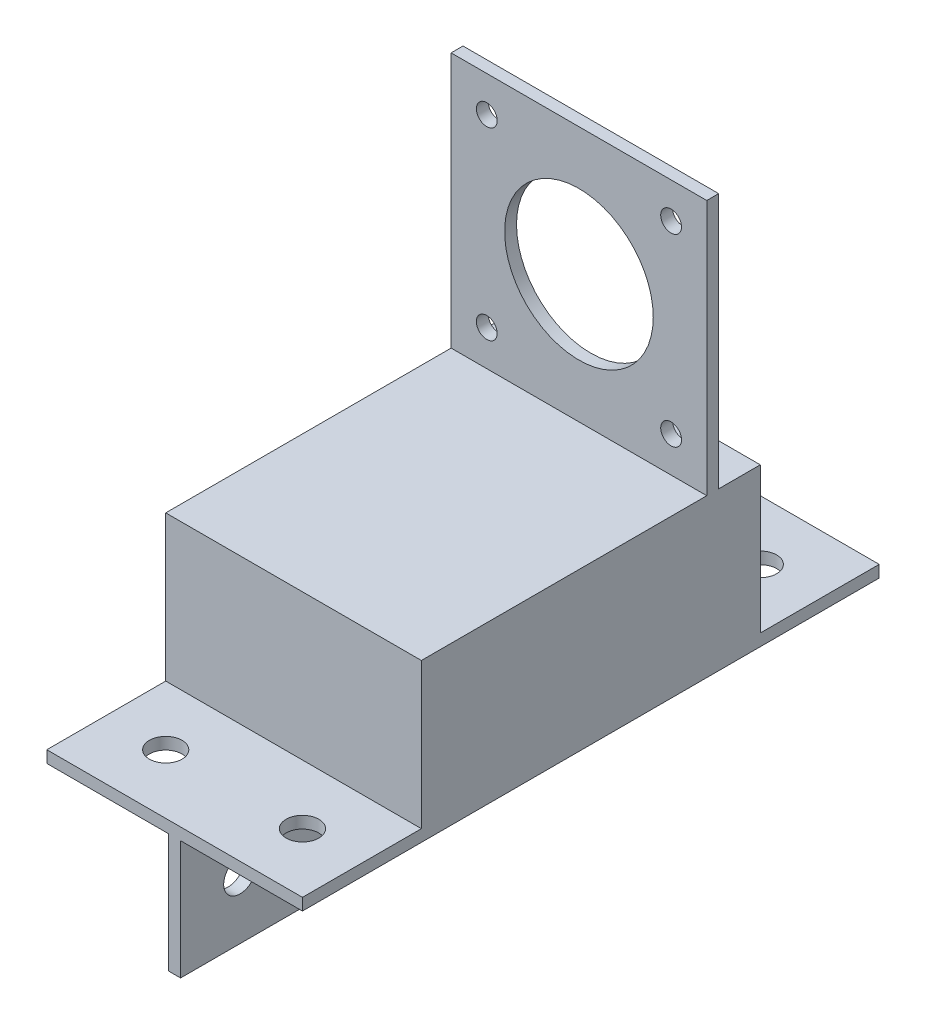
from build123d import *

# Parameters (mm, degrees)
SKETCH1_W           = 43
SKETCH1_H           = 2
BOSS_EXTRUDE1_DEPTH = 43
SKETCH1_3_W         = 43
SKETCH1_3_H         = 97
BOSS_EXTRUDE2_DEPTH = 26.5
CUT_EXTRUDE1_REACH  = 85.278
SKETCH2_R           = 12.5
SKETCH2_R_2         = 1.75
CUT_EXTRUDE2_REACH  = 70.29
SKETCH1_4_R         = 2.75
SKETCH3_W           = 43
SKETCH3_H           = 20
CUT_EXTRUDE3_DEPTH  = 24.5
SKETCH4_W           = 2
SKETCH4_H           = 97
BOSS_EXTRUDE3_DEPTH = 20
CUT_EXTRUDE4_REACH  = 72.857
SKETCH5_R           = 2.75


with BuildPart() as part:
    # Sketch1 → Boss-Extrude1 (new body)
    with BuildSketch(Plane(origin=(0, 0, 0), x_dir=(1, 0, 0), z_dir=(0, 1, 0))):
        with Locations((0, 20.5)):
            Rectangle(SKETCH1_W, SKETCH1_H)
    extrude(amount=BOSS_EXTRUDE1_DEPTH)

    # Sketch1<3> → Boss-Extrude2 (add)
    with BuildSketch(Plane(origin=(0, 0, 0), x_dir=(1, 0, 0), z_dir=(0, 1, 0))):
        Rectangle(SKETCH1_3_W, SKETCH1_3_H)
    extrude(amount=-BOSS_EXTRUDE2_DEPTH)

    # Sketch2 → Cut-Extrude1 (cut, up to next)
    with BuildSketch(Plane.XY.offset(-19.5), mode=Mode.PRIVATE) as cut_extrude1_sk1:
        with Locations((0, 21.5)):
            Circle(SKETCH2_R)
    cut_extrude1_tool1 = extrude(cut_extrude1_sk1.sketch, amount=-CUT_EXTRUDE1_REACH, mode=Mode.PRIVATE) & part.part
    # Sketch2 → Cut-Extrude1 (cut, up to next)
    with BuildSketch(Plane.XY.offset(-19.5), mode=Mode.PRIVATE) as cut_extrude1_sk2:
        with Locations((-15.5, 37)):
            Circle(SKETCH2_R_2)
    cut_extrude1_tool2 = extrude(cut_extrude1_sk2.sketch, amount=-CUT_EXTRUDE1_REACH, mode=Mode.PRIVATE) & part.part
    # Sketch2 → Cut-Extrude1 (cut, up to next)
    with BuildSketch(Plane.XY.offset(-19.5), mode=Mode.PRIVATE) as cut_extrude1_sk3:
        with Locations((15.5, 37)):
            Circle(SKETCH2_R_2)
    cut_extrude1_tool3 = extrude(cut_extrude1_sk3.sketch, amount=-CUT_EXTRUDE1_REACH, mode=Mode.PRIVATE) & part.part
    # Sketch2 → Cut-Extrude1 (cut, up to next)
    with BuildSketch(Plane.XY.offset(-19.5), mode=Mode.PRIVATE) as cut_extrude1_sk4:
        with Locations((15.5, 6)):
            Circle(SKETCH2_R_2)
    cut_extrude1_tool4 = extrude(cut_extrude1_sk4.sketch, amount=-CUT_EXTRUDE1_REACH, mode=Mode.PRIVATE) & part.part
    # Sketch2 → Cut-Extrude1 (cut, up to next)
    with BuildSketch(Plane.XY.offset(-19.5), mode=Mode.PRIVATE) as cut_extrude1_sk5:
        with Locations((-15.5, 6)):
            Circle(SKETCH2_R_2)
    cut_extrude1_tool5 = extrude(cut_extrude1_sk5.sketch, amount=-CUT_EXTRUDE1_REACH, mode=Mode.PRIVATE) & part.part
    add(cut_extrude1_tool1.solids().sort_by_distance((0, 21.5, -19.5))[0], mode=Mode.SUBTRACT)
    add(cut_extrude1_tool2.solids().sort_by_distance((-15.5, 37, -19.5))[0], mode=Mode.SUBTRACT)
    add(cut_extrude1_tool3.solids().sort_by_distance((15.5, 37, -19.5))[0], mode=Mode.SUBTRACT)
    add(cut_extrude1_tool4.solids().sort_by_distance((15.5, 6, -19.5))[0], mode=Mode.SUBTRACT)
    add(cut_extrude1_tool5.solids().sort_by_distance((-15.5, 6, -19.5))[0], mode=Mode.SUBTRACT)

    # Sketch1<4> → Cut-Extrude2 (cut, up to next)
    with BuildSketch(Plane(origin=(0, 0, 0), x_dir=(1, 0, 0), z_dir=(0, 1, 0)), mode=Mode.PRIVATE) as cut_extrude2_sk1:
        with Locations((-11.5, 38.5)):
            Circle(SKETCH1_4_R)
    cut_extrude2_tool1 = extrude(cut_extrude2_sk1.sketch, amount=-CUT_EXTRUDE2_REACH, mode=Mode.PRIVATE) & part.part
    # Sketch1<4> → Cut-Extrude2 (cut, up to next)
    with BuildSketch(Plane(origin=(0, 0, 0), x_dir=(1, 0, 0), z_dir=(0, 1, 0)), mode=Mode.PRIVATE) as cut_extrude2_sk2:
        with Locations((11.5, 38.5)):
            Circle(SKETCH1_4_R)
    cut_extrude2_tool2 = extrude(cut_extrude2_sk2.sketch, amount=-CUT_EXTRUDE2_REACH, mode=Mode.PRIVATE) & part.part
    # Sketch1<4> → Cut-Extrude2 (cut, up to next)
    with BuildSketch(Plane(origin=(0, 0, 0), x_dir=(1, 0, 0), z_dir=(0, 1, 0)), mode=Mode.PRIVATE) as cut_extrude2_sk3:
        with Locations((-11.5, -38.5)):
            Circle(SKETCH1_4_R)
    cut_extrude2_tool3 = extrude(cut_extrude2_sk3.sketch, amount=-CUT_EXTRUDE2_REACH, mode=Mode.PRIVATE) & part.part
    # Sketch1<4> → Cut-Extrude2 (cut, up to next)
    with BuildSketch(Plane(origin=(0, 0, 0), x_dir=(1, 0, 0), z_dir=(0, 1, 0)), mode=Mode.PRIVATE) as cut_extrude2_sk4:
        with Locations((11.5, -38.5)):
            Circle(SKETCH1_4_R)
    cut_extrude2_tool4 = extrude(cut_extrude2_sk4.sketch, amount=-CUT_EXTRUDE2_REACH, mode=Mode.PRIVATE) & part.part
    add(cut_extrude2_tool1.solids().sort_by_distance((-11.5, 0, -38.5))[0], mode=Mode.SUBTRACT)
    add(cut_extrude2_tool2.solids().sort_by_distance((11.5, 0, -38.5))[0], mode=Mode.SUBTRACT)
    add(cut_extrude2_tool3.solids().sort_by_distance((-11.5, 0, 38.5))[0], mode=Mode.SUBTRACT)
    add(cut_extrude2_tool4.solids().sort_by_distance((11.5, 0, 38.5))[0], mode=Mode.SUBTRACT)

    # Sketch3 → Cut-Extrude3 (cut)
    with BuildSketch(Plane(origin=(0, 0, 0), x_dir=(1, 0, 0), z_dir=(0, 1, 0))):
        with Locations((0, -38.5)):
            Rectangle(SKETCH3_W, SKETCH3_H)
        with Locations((0, 38.5)):
            Rectangle(SKETCH3_W, SKETCH3_H)
    extrude(amount=-CUT_EXTRUDE3_DEPTH, mode=Mode.SUBTRACT)

    # Sketch4 → Boss-Extrude3 (add)
    with BuildSketch(Plane.XZ.offset(26.5)):
        Rectangle(SKETCH4_W, SKETCH4_H)
    extrude(amount=BOSS_EXTRUDE3_DEPTH)

    # Sketch5 → Cut-Extrude4 (cut, up to next)
    with BuildSketch(Plane(origin=(1, 0, 0), x_dir=(0, 0, -1), z_dir=(1, 0, 0)), mode=Mode.PRIVATE) as cut_extrude4_sk1:
        with Locations((38.5, -36.5)):
            Circle(SKETCH5_R)
    cut_extrude4_tool1 = extrude(cut_extrude4_sk1.sketch, amount=-CUT_EXTRUDE4_REACH, mode=Mode.PRIVATE) & part.part
    # Sketch5 → Cut-Extrude4 (cut, up to next)
    with BuildSketch(Plane(origin=(1, 0, 0), x_dir=(0, 0, -1), z_dir=(1, 0, 0)), mode=Mode.PRIVATE) as cut_extrude4_sk2:
        with Locations((-38.5, -36.5)):
            Circle(SKETCH5_R)
    cut_extrude4_tool2 = extrude(cut_extrude4_sk2.sketch, amount=-CUT_EXTRUDE4_REACH, mode=Mode.PRIVATE) & part.part
    add(cut_extrude4_tool1.solids().sort_by_distance((1, -36.5, -38.5))[0], mode=Mode.SUBTRACT)
    add(cut_extrude4_tool2.solids().sort_by_distance((1, -36.5, 38.5))[0], mode=Mode.SUBTRACT)


solid = part.part
